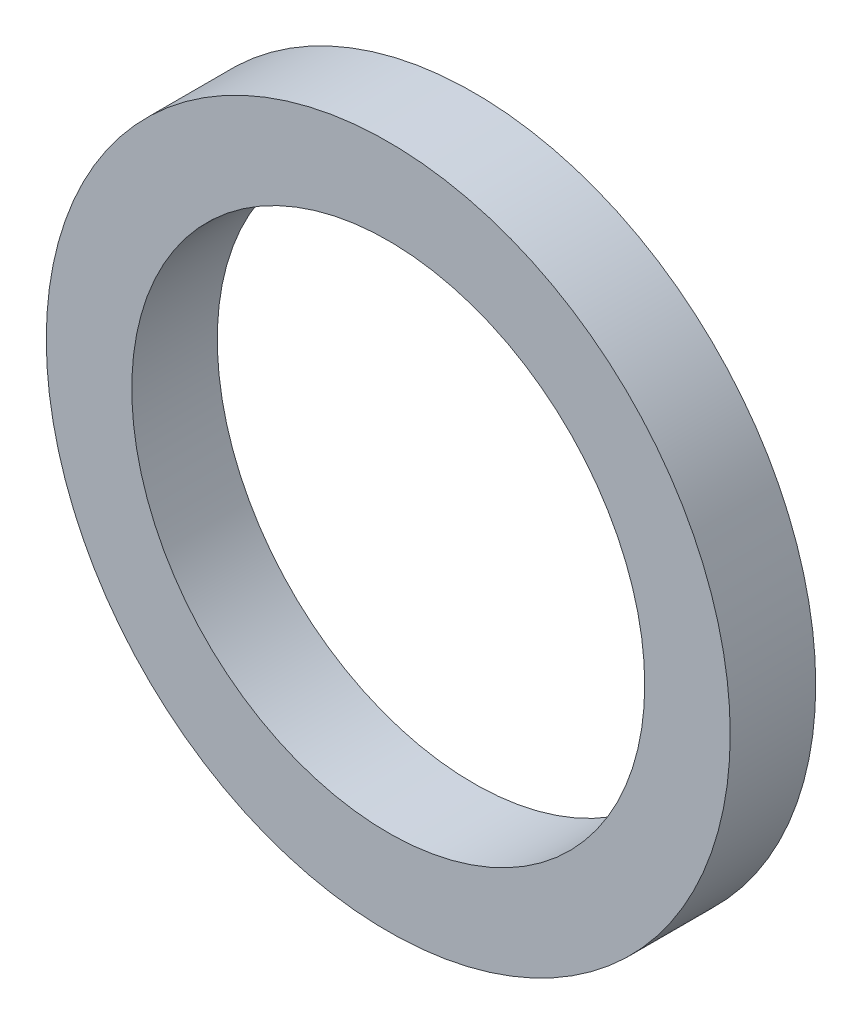
from build123d import *

# Parameters (mm, degrees)
SKETCH_1_R      = 4
SKETCH_1_R_2    = 3
EXTRUDE_1_DEPTH = 1


with BuildPart() as part:
    # 草图1 → 凸台-拉伸1 (new body)
    with BuildSketch(Plane.XY):
        Circle(SKETCH_1_R)
        Circle(SKETCH_1_R_2, mode=Mode.SUBTRACT)
    extrude(amount=EXTRUDE_1_DEPTH)


solid = part.part
